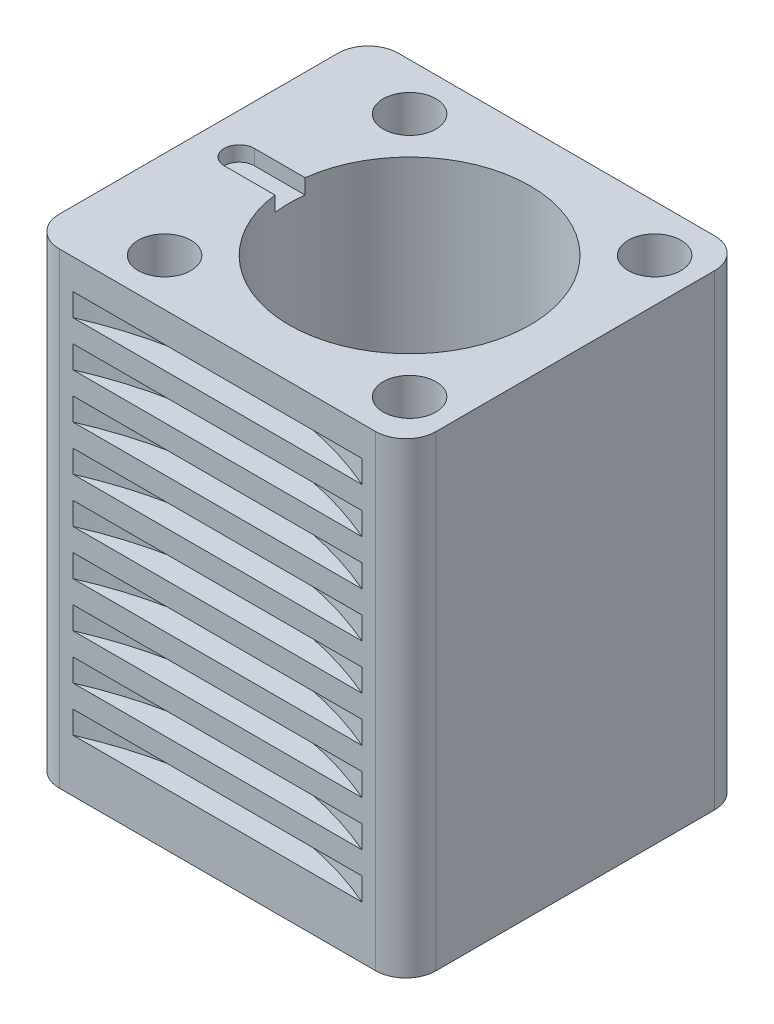
from build123d import *

# Parameters (mm, degrees)
BOSS_EXTRUDE2_DEPTH     = 62
SKETCH4_R               = 18
BOSS_EXTRUDE3_DEPTH     = 2
SKETCH5_R               = 16
CUT_EXTRUDE1_DEPTH      = 74.391075752
CUT_EXTRUDE2_DEPTH      = 2
SKETCH7_R               = 3.5
CUT_EXTRUDE3_DEPTH      = 74.391075752
SKETCH8_W               = 48
SKETCH8_H               = 3
LPATTERN1_COUNT         = 9
LPATTERN1_PITCH         = 6
MIRROR1_COPY_1_SKETCH_W = 48
MIRROR1_COPY_1_SKETCH_H = 3
MIRROR1_COPY_2_SKETCH_W = 48
MIRROR1_COPY_2_SKETCH_H = 3
MIRROR1_COPY_3_SKETCH_W = 48
MIRROR1_COPY_3_SKETCH_H = 3
MIRROR1_COPY_4_SKETCH_W = 48
MIRROR1_COPY_4_SKETCH_H = 3
MIRROR1_COPY_5_SKETCH_W = 48
MIRROR1_COPY_5_SKETCH_H = 3
MIRROR1_COPY_6_SKETCH_W = 48
MIRROR1_COPY_6_SKETCH_H = 3
MIRROR1_COPY_7_SKETCH_W = 48
MIRROR1_COPY_7_SKETCH_H = 3
MIRROR1_COPY_8_SKETCH_W = 48
MIRROR1_COPY_8_SKETCH_H = 3
SKETCH10_W              = 48
SKETCH10_H              = 3
LPATTERN2_COUNT         = 9
LPATTERN2_PITCH         = 6


with BuildPart() as part:
    # Sketch3 → Boss-Extrude2 (new body)
    with BuildSketch(Plane(origin=(0, 0, 0), x_dir=(1, 0, 0), z_dir=(0, 1, 0))):
        with BuildLine():
            Line((18, 22.5), (-24, 22.5))
            ThreePointArc((-24, 22.5), (-26.828427125, 21.328427125), (-28, 18.5))
            Line((-28, 18.5), (-28, -18.5))
            ThreePointArc((-28, -18.5), (-26.828427125, -21.328427125), (-24, -22.5))
            Line((-24, -22.5), (18, -22.5))
            ThreePointArc((18, -22.5), (20.828427125, -21.328427125), (22, -18.5))
            Line((22, -18.5), (22, 18.5))
            ThreePointArc((22, 18.5), (20.828427125, 21.328427125), (18, 22.5))
        make_face()
    extrude(amount=BOSS_EXTRUDE2_DEPTH)

    # Sketch4 → Boss-Extrude3 (add)
    with BuildSketch(Plane.XZ):
        with Locations(Location((0, 0, 0), (0, 0, 270))):
            Circle(SKETCH4_R)
    extrude(amount=BOSS_EXTRUDE3_DEPTH)

    # Sketch5 → Cut-Extrude1 (cut, through all)
    with BuildSketch(Plane.XZ.offset(2)):
        with Locations(Location((0, 0, 0), (0, 0, 270))):
            Circle(SKETCH5_R)
    extrude(amount=-CUT_EXTRUDE1_DEPTH, mode=Mode.SUBTRACT)

    # Sketch6 → Cut-Extrude2 (cut)
    with BuildSketch(Plane(origin=(0, 62, 0), x_dir=(1, 0, 0), z_dir=(0, 1, 0))):
        with BuildLine():
            Line((-22.61, 2), (-13.643461212, 2))
            Line((-13.643461212, 2), (-13.643461212, -2))
            Line((-13.643461212, -2), (-22.61, -2))
            ThreePointArc((-22.61, -2), (-24.61, 0), (-22.61, 2))
        make_face()
    extrude(amount=-CUT_EXTRUDE2_DEPTH, mode=Mode.SUBTRACT)

    # Sketch7 → Cut-Extrude3 (cut, through all)
    with BuildSketch(Plane(origin=(0, 62, 0), x_dir=(1, 0, 0), z_dir=(0, 1, 0))):
        with Locations(Location((16.263455967, 16.263455967, 0), (0, 0, 270))):
            Circle(SKETCH7_R)
        with Locations(Location((16.263455967, -16.263455967, 0), (0, 0, 270))):
            Circle(SKETCH7_R)
        with Locations(Location((-16.263455967, -16.263455967, 0), (0, 0, 270))):
            Circle(SKETCH7_R)
        with Locations(Location((-16.263455967, 16.263455967, 0), (0, 0, 270))):
            Circle(SKETCH7_R)
    extrude(amount=-CUT_EXTRUDE3_DEPTH, mode=Mode.SUBTRACT)

    # Sketch8 → Cut-Revolve1 (revolve, cut)
    with BuildSketch(Plane(origin=(-3, 0, 0), x_dir=(0, 0, -1), z_dir=(1, 0, 0))):
        with Locations((-42.5, 56.5)):
            Rectangle(SKETCH8_W, SKETCH8_H)
    cut_revolve1 = revolve(axis=Axis((-3, 58, 66.5), (0, -1, 0)), mode=Mode.SUBTRACT)

    # LPattern1: Cut-Revolve1 ×9
    with Locations(*[(0, -i * LPATTERN1_PITCH, 0) for i in range(1, LPATTERN1_COUNT)]):
        add(cut_revolve1, mode=Mode.SUBTRACT)

    # Mirror1: Cut-Revolve1 across plane
    add(cut_revolve1.mirror(Plane.XY), mode=Mode.SUBTRACT)

    # Mirror1 copy 1 sketch → Mirror1 copy 1 (revolve, cut)
    with BuildSketch(Plane(origin=(-3, -6, 0), x_dir=(0, 0, 1), z_dir=(1, 0, 0))):
        with Locations((-42.5, -56.5)):
            Rectangle(MIRROR1_COPY_1_SKETCH_W, MIRROR1_COPY_1_SKETCH_H)
    revolve(axis=Axis((-3, 52, -66.5), (0, 1, 0)), mode=Mode.SUBTRACT)

    # Mirror1 copy 2 sketch → Mirror1 copy 2 (revolve, cut)
    with BuildSketch(Plane(origin=(-3, -12, 0), x_dir=(0, 0, 1), z_dir=(1, 0, 0))):
        with Locations((-42.5, -56.5)):
            Rectangle(MIRROR1_COPY_2_SKETCH_W, MIRROR1_COPY_2_SKETCH_H)
    revolve(axis=Axis((-3, 46, -66.5), (0, 1, 0)), mode=Mode.SUBTRACT)

    # Mirror1 copy 3 sketch → Mirror1 copy 3 (revolve, cut)
    with BuildSketch(Plane(origin=(-3, -18, 0), x_dir=(0, 0, 1), z_dir=(1, 0, 0))):
        with Locations((-42.5, -56.5)):
            Rectangle(MIRROR1_COPY_3_SKETCH_W, MIRROR1_COPY_3_SKETCH_H)
    revolve(axis=Axis((-3, 40, -66.5), (0, 1, 0)), mode=Mode.SUBTRACT)

    # Mirror1 copy 4 sketch → Mirror1 copy 4 (revolve, cut)
    with BuildSketch(Plane(origin=(-3, -24, 0), x_dir=(0, 0, 1), z_dir=(1, 0, 0))):
        with Locations((-42.5, -56.5)):
            Rectangle(MIRROR1_COPY_4_SKETCH_W, MIRROR1_COPY_4_SKETCH_H)
    revolve(axis=Axis((-3, 34, -66.5), (0, 1, 0)), mode=Mode.SUBTRACT)

    # Mirror1 copy 5 sketch → Mirror1 copy 5 (revolve, cut)
    with BuildSketch(Plane(origin=(-3, -30, 0), x_dir=(0, 0, 1), z_dir=(1, 0, 0))):
        with Locations((-42.5, -56.5)):
            Rectangle(MIRROR1_COPY_5_SKETCH_W, MIRROR1_COPY_5_SKETCH_H)
    revolve(axis=Axis((-3, 28, -66.5), (0, 1, 0)), mode=Mode.SUBTRACT)

    # Mirror1 copy 6 sketch → Mirror1 copy 6 (revolve, cut)
    with BuildSketch(Plane(origin=(-3, -36, 0), x_dir=(0, 0, 1), z_dir=(1, 0, 0))):
        with Locations((-42.5, -56.5)):
            Rectangle(MIRROR1_COPY_6_SKETCH_W, MIRROR1_COPY_6_SKETCH_H)
    revolve(axis=Axis((-3, 22, -66.5), (0, 1, 0)), mode=Mode.SUBTRACT)

    # Mirror1 copy 7 sketch → Mirror1 copy 7 (revolve, cut)
    with BuildSketch(Plane(origin=(-3, -42, 0), x_dir=(0, 0, 1), z_dir=(1, 0, 0))):
        with Locations((-42.5, -56.5)):
            Rectangle(MIRROR1_COPY_7_SKETCH_W, MIRROR1_COPY_7_SKETCH_H)
    revolve(axis=Axis((-3, 16, -66.5), (0, 1, 0)), mode=Mode.SUBTRACT)

    # Mirror1 copy 8 sketch → Mirror1 copy 8 (revolve, cut)
    with BuildSketch(Plane(origin=(-3, -48, 0), x_dir=(0, 0, 1), z_dir=(1, 0, 0))):
        with Locations((-42.5, -56.5)):
            Rectangle(MIRROR1_COPY_8_SKETCH_W, MIRROR1_COPY_8_SKETCH_H)
    revolve(axis=Axis((-3, 10, -66.5), (0, 1, 0)), mode=Mode.SUBTRACT)

    # Sketch10 → Cut-Revolve3 (revolve, cut)
    with BuildSketch(Plane.XY):
        with Locations((-48, 56.5)):
            Rectangle(SKETCH10_W, SKETCH10_H)
    cut_revolve3 = revolve(axis=Axis((-72, 58, 0), (0, -1, 0)), mode=Mode.SUBTRACT)

    # LPattern2: Cut-Revolve3 ×9
    with Locations(*[(0, -i * LPATTERN2_PITCH, 0) for i in range(1, LPATTERN2_COUNT)]):
        add(cut_revolve3, mode=Mode.SUBTRACT)


solid = part.part
